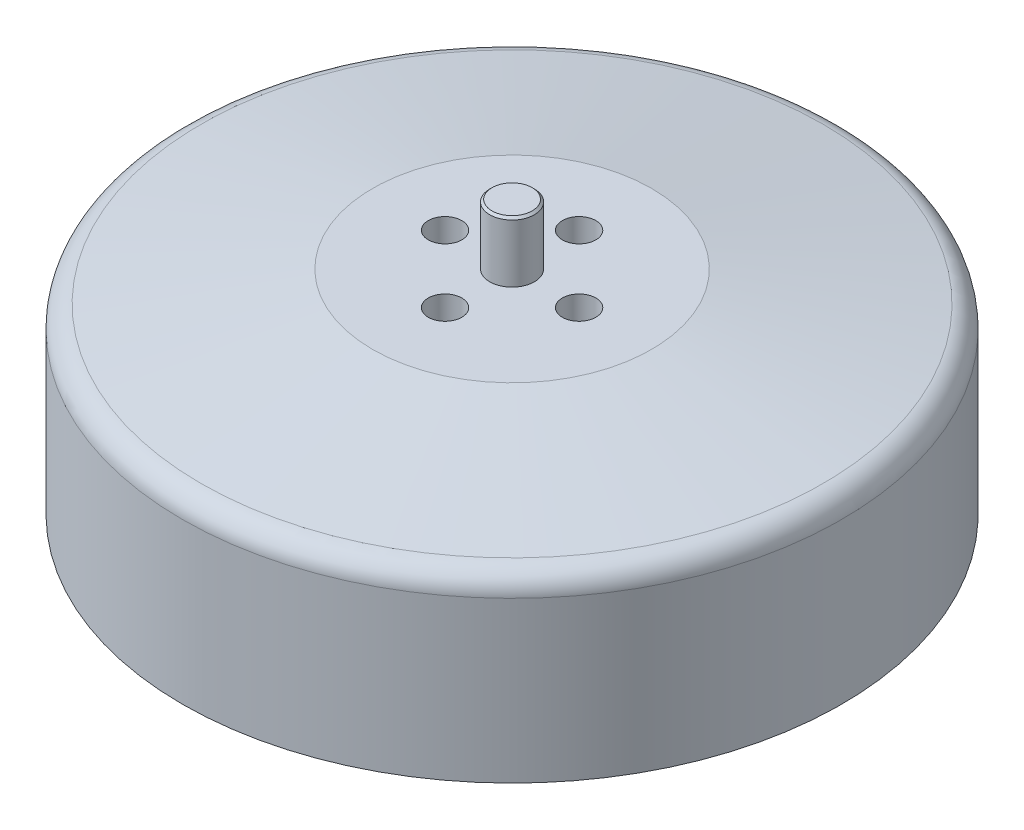
from build123d import *

# Parameters (mm, degrees)
SKETCH1_R           = 29.5
SKETCH1_R_2         = 27.5
BOSS_EXTRUDE2_DEPTH = 14
SKETCH3_R           = 29.5
SKETCH3_R_2         = 1.5
BOSS_EXTRUDE3_DEPTH = 5
CHAMFER1_SIZE       = 3
CHAMFER1_SIZE2      = 17.013845459
FILLET1_R           = 2
SKETCH4_R           = 2
BOSS_EXTRUDE4_DEPTH = 5.4
CHAMFER2_SIZE       = 0.2


with BuildPart() as part:
    # Sketch1 → Boss-Extrude2 (new body)
    with BuildSketch(Plane(origin=(0, 0, 0), x_dir=(1, 0, 0), z_dir=(0, 1, 0))):
        with Locations(Location((0, 0, 0), (0, 0, 270))):
            Circle(SKETCH1_R)
        with Locations(Location((0, 0, 0), (0, 0, 270))):
            Circle(SKETCH1_R_2, mode=Mode.SUBTRACT)
    extrude(amount=BOSS_EXTRUDE2_DEPTH)

    # Sketch3 → Boss-Extrude3 (add)
    with BuildSketch(Plane(origin=(0, 14, 0), x_dir=(1, 0, 0), z_dir=(0, 1, 0))):
        with Locations(Location((0, 0, 0), (0, 0, 270))):
            Circle(SKETCH3_R)
        with Locations(Location((0, 6, 0), (0, 0, 270))):
            Circle(SKETCH3_R_2, mode=Mode.SUBTRACT)
        with Locations(Location((6, 0, 0), (0, 0, 270))):
            Circle(SKETCH3_R_2, mode=Mode.SUBTRACT)
        with Locations(Location((0, -6, 0), (0, 0, 270))):
            Circle(SKETCH3_R_2, mode=Mode.SUBTRACT)
        with Locations(Location((-6, 0, 0), (0, 0, 270))):
            Circle(SKETCH3_R_2, mode=Mode.SUBTRACT)
    extrude(amount=BOSS_EXTRUDE3_DEPTH)

    # Chamfer1
    chamfer1_edges = [part.edges().sort_by_distance(p)[0] for p in [
        (0, 19, -29.5),
    ]]
    chamfer1_side = [part.faces().sort_by_distance(p)[0] for p in [
        (0, 9.5, -29.5),
    ]]
    chamfer(chamfer1_edges, length=CHAMFER1_SIZE, length2=CHAMFER1_SIZE2, reference=chamfer1_side[0])

    # Fillet1
    fillet1_edges = [part.edges().sort_by_distance(p)[0] for p in [
        (0, 16, -29.5),
    ]]
    fillet(fillet1_edges, radius=FILLET1_R)

    # Sketch4 → Boss-Extrude4 (add)
    with BuildSketch(Plane(origin=(0, 19, 0), x_dir=(1, 0, 0), z_dir=(0, 1, 0))):
        with Locations(Location((0, 0, 0), (0, 0, 90))):
            Circle(SKETCH4_R)
    extrude(amount=BOSS_EXTRUDE4_DEPTH)

    # Chamfer2
    chamfer2_edges = [part.edges().sort_by_distance(p)[0] for p in [
        (0, 24.4, 2),
    ]]
    chamfer(chamfer2_edges, length=CHAMFER2_SIZE)


solid = part.part
